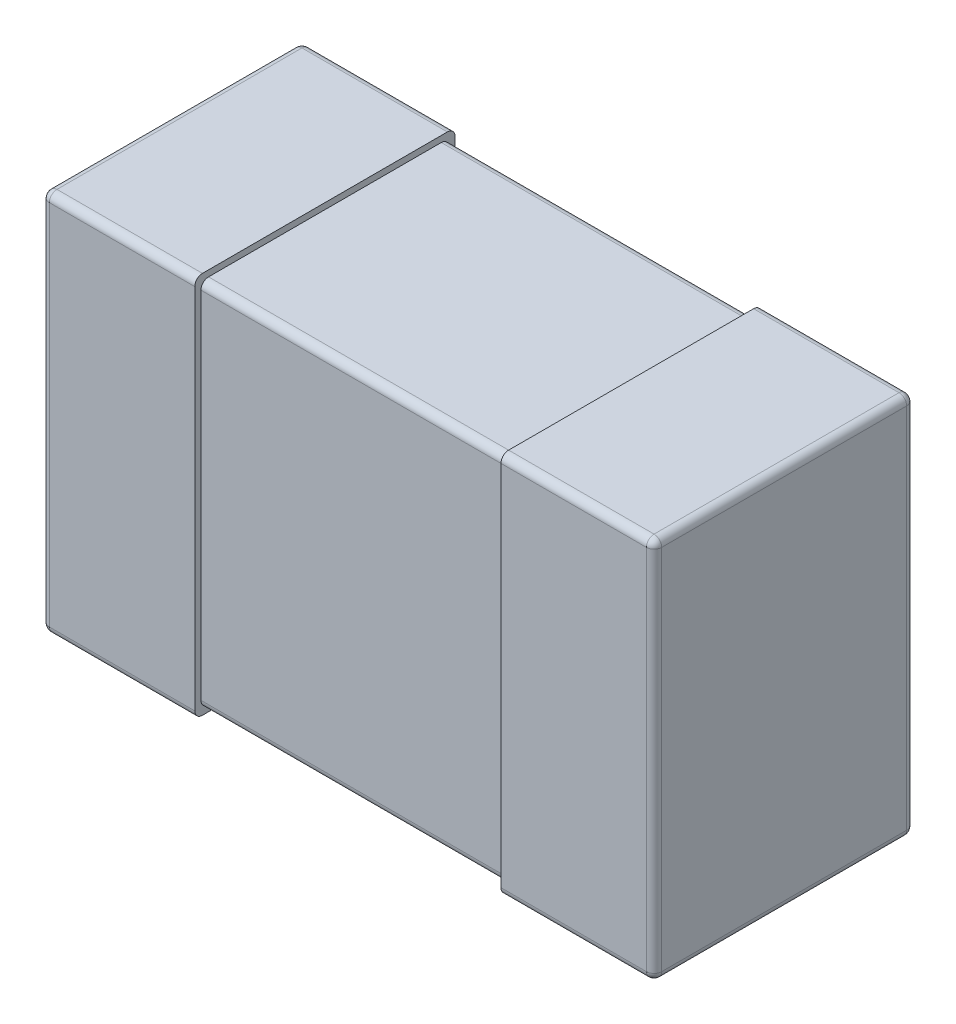
from build123d import *

# Parameters (mm, degrees)
SKETCH_3_W        = 0.5
SKETCH_3_H        = 1.25
EXTRUDE_3_DEPTH   = 0.85
EXTRUDE_3_2_DEPTH = 0.85
EXTRUDE_START     = 0.02
SKETCH_4_W        = 1
SKETCH_4_H        = 1.21
EXTRUDE_3_3_DEPTH = 0.81
FILLET_2_R        = 0.025
FILLET_3_R        = 0.025


with BuildPart() as part:
    # Эскиз3 → Extrude 3 (new body)
    with BuildSketch(Plane.XY):
        with Locations((0.75, 0)):
            Rectangle(SKETCH_3_W, SKETCH_3_H)
    extrude(amount=EXTRUDE_3_DEPTH)



with BuildPart() as body_2:
    # Эскиз3 → Extrude 3 2 (new body)
    with BuildSketch(Plane.XY):
        with Locations((-0.75, 0)):
            Rectangle(SKETCH_3_W, SKETCH_3_H)
    extrude(amount=EXTRUDE_3_2_DEPTH)


with BuildPart() as part_1:
    add(part.part)

    add(body_2.part)  # Extrude 3 3 merges body 2
    # Эскиз4 → Extrude 3 3 (add)
    with BuildSketch(Plane.XY.offset(EXTRUDE_START)):
        Rectangle(SKETCH_4_W, SKETCH_4_H)
    extrude(amount=EXTRUDE_3_3_DEPTH)

    # Скругление2
    fillet_2_edges = [part_1.edges().sort_by_distance(p)[0] for p in [
        (-1, 0, 0.85),
        (-0.75, -0.625, 0.85),
        (0.75, 0.625, 0),
        (1, 0.625, 0.425),
        (0.75, -0.625, 0),
        (1, 0, 0),
        (1, -0.625, 0.425),
        (0.75, 0.625, 0.85),
        (0.75, -0.625, 0.85),
        (1, 0, 0.85),
        (-0.75, -0.625, 0),
        (-1, 0, 0),
        (-0.75, 0.625, 0),
        (-0.75, 0.625, 0.85),
        (-1, -0.625, 0.425),
        (-1, 0.625, 0.425),
    ]]
    fillet(fillet_2_edges, radius=FILLET_2_R)

    # Скругление3
    fillet_3_edges = [part_1.edges().sort_by_distance(p)[0] for p in [
        (0, -0.605, 0.02),
        (0, 0.605, 0.02),
        (0, 0.605, 0.83),
        (0, -0.605, 0.83),
    ]]
    fillet(fillet_3_edges, radius=FILLET_3_R)


solid = part_1.part
